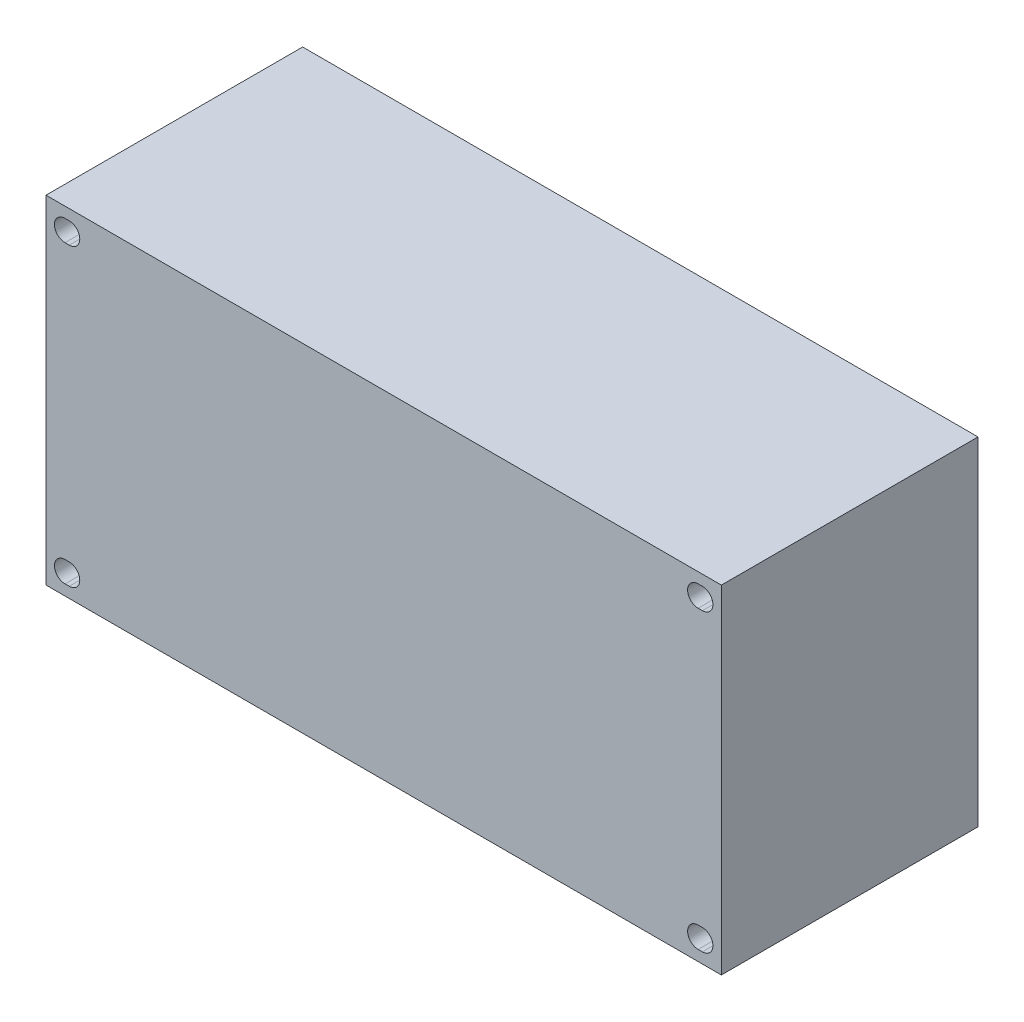
from build123d import *

# Parameters (mm, degrees)
SKETCH1_W            = 101.6
SKETCH1_H            = 50.8
BOSS_EXTRUDE1_DEPTH  = 38.608
CUT_EXTRUDE1_DEPTH   = 69.67588852
MIRROR2_COPY_1_DEPTH = 69.67588852


with BuildPart() as part:
    # Sketch1 → Boss-Extrude1 (new body)
    with BuildSketch(Plane.XY):
        Rectangle(SKETCH1_W, SKETCH1_H)
    extrude(amount=BOSS_EXTRUDE1_DEPTH)

    # Sketch4 → Cut-Extrude1 (cut, through all)
    with BuildSketch(Plane.XY.offset(38.608)):
        with BuildLine():
            Line((47.3075, 23.8125), (47.9425, 23.8125))
            ThreePointArc((47.9425, 23.8125), (49.53, 22.225), (47.9425, 20.6375))
            Line((47.9425, 20.6375), (47.3075, 20.6375))
            ThreePointArc((47.3075, 20.6375), (45.72, 22.225), (47.3075, 23.8125))
        make_face()
    cut_extrude1 = extrude(amount=-CUT_EXTRUDE1_DEPTH, mode=Mode.SUBTRACT)

    # Mirror1: Cut-Extrude1 across plane
    add(cut_extrude1.mirror(Plane.ZX), mode=Mode.SUBTRACT)

    # Mirror2: Cut-Extrude1 across plane
    add(cut_extrude1.mirror(Plane(origin=(0, 0, 0), x_dir=(0, 0, 1), z_dir=(1, 0, 0))), mode=Mode.SUBTRACT)

    # Mirror2 copy 1 sketch → Mirror2 copy 1 (cut, through all)
    with BuildSketch(Plane(origin=(0, 0, 38.608), x_dir=(-1, 0, 0), z_dir=(0, 0, 1))):
        with BuildLine():
            Line((47.3075, 23.8125), (47.9425, 23.8125))
            ThreePointArc((47.9425, 23.8125), (49.53, 22.225), (47.9425, 20.6375))
            Line((47.9425, 20.6375), (47.3075, 20.6375))
            ThreePointArc((47.3075, 20.6375), (45.72, 22.225), (47.3075, 23.8125))
        make_face()
    extrude(amount=-MIRROR2_COPY_1_DEPTH, mode=Mode.SUBTRACT)


solid = part.part
